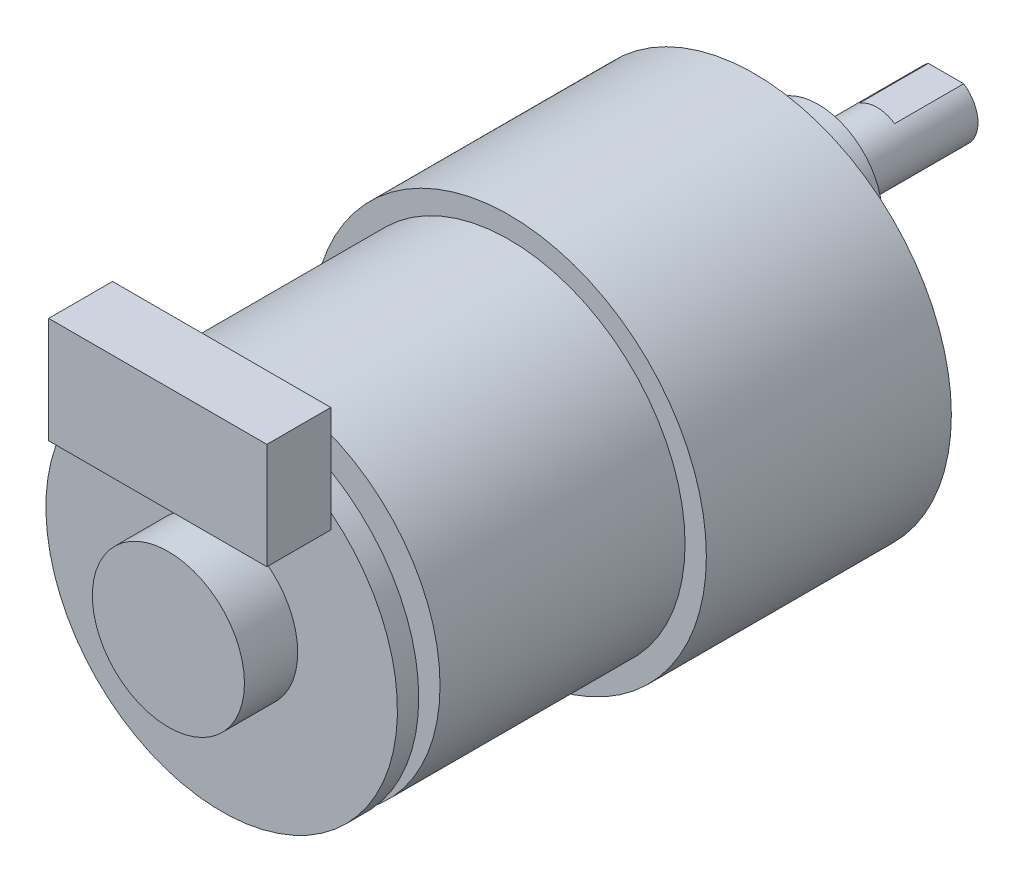
from build123d import *

# Parameters (mm, degrees)
SKETCH_1_R               = 18.5
EXTRUDE_1_DEPTH          = 23
SKETCH_2_R               = 16.5
EXTRUDE_2_DEPTH          = 23
SKETCH_3_R               = 6
EXTRUDE_3_DEPTH          = 6
SKETCH_4_R               = 3
EXTRUDE_4_DEPTH          = 12
CUT_EXTRUDE_1_DEPTH      = 53.919750566
CUT_EXTRUDE_1_DEPTH_BACK = 53.919750566
SKETCH_5_W               = 8.515862451
SKETCH_5_H               = 10.43869594
SKETCH_6_R               = 1
EXTRUDE_5_DEPTH          = 2
SKETCH_7_R               = 16.5
EXTRUDE_6_DEPTH          = 2
SKETCH_8_R               = 7.139531777
EXTRUDE_7_DEPTH          = 5
SKETCH_9_W               = 20.48733328
SKETCH_9_H               = 9.95175006
EXTRUDE_8_DEPTH          = 6
SKETCH_10_R              = 1.5
CUT_EXTRUDE_2_DEPTH      = 2


with BuildPart() as part:
    # 草图1 → 凸台-拉伸1 (new body)
    with BuildSketch(Plane.XY):
        Circle(SKETCH_1_R)
    extrude(amount=EXTRUDE_1_DEPTH)

    # 草图2 → 凸台-拉伸2 (add)
    with BuildSketch(Plane.XY.offset(23)):
        Circle(SKETCH_2_R)
    extrude(amount=EXTRUDE_2_DEPTH)

    # 草图3 → 凸台-拉伸3 (add)
    with BuildSketch(Plane(origin=(0, 0, 0), x_dir=(-1, 0, 0), z_dir=(0, 0, -1))):
        with Locations(Location((0, 7, 0), (0, 0, 180))):
            Circle(SKETCH_3_R)
    extrude(amount=EXTRUDE_3_DEPTH)

    # 草图4 → 凸台-拉伸4 (add)
    with BuildSketch(Plane(origin=(0, 0, -6), x_dir=(-1, 0, 0), z_dir=(0, 0, -1))):
        with Locations((0, 7)):
            Circle(SKETCH_4_R)
    extrude(amount=EXTRUDE_4_DEPTH)

    # 草图5 → 切除-拉伸1 (cut, two sides: drawn at the far end of the back side and taken through both)
    with BuildSketch(Plane(origin=(0, 0, 0), x_dir=(0, 0, -1), z_dir=(1, 0, 0)).offset(-CUT_EXTRUDE_1_DEPTH_BACK)):
        with Locations((15.772473003, 14.71934797)):
            Rectangle(SKETCH_5_W, SKETCH_5_H)
    extrude(amount=CUT_EXTRUDE_1_DEPTH + CUT_EXTRUDE_1_DEPTH_BACK, mode=Mode.SUBTRACT)

    # 草图6 → 凸台-拉伸5 (add)
    with BuildSketch(Plane.XY.offset(46)):
        with Locations((-10, 0)):
            Circle(SKETCH_6_R)
        with Locations((10, 0)):
            Circle(SKETCH_6_R)
    extrude(amount=EXTRUDE_5_DEPTH)

    # 草图7 → 凸台-拉伸6 (add)
    with BuildSketch(Plane.XY.offset(48)):
        Circle(SKETCH_7_R)
    extrude(amount=EXTRUDE_6_DEPTH)

    # 草图8 → 凸台-拉伸7 (add)
    with BuildSketch(Plane.XY.offset(50)):
        Circle(SKETCH_8_R)
    extrude(amount=EXTRUDE_7_DEPTH)

    # 草图9 → 凸台-拉伸8 (add)
    with BuildSketch(Plane.XY.offset(50)):
        with Locations((0, 16.5)):
            Rectangle(SKETCH_9_W, SKETCH_9_H)
    extrude(amount=EXTRUDE_8_DEPTH)

    # 草图10 → 切除-拉伸2 (cut)
    with BuildSketch(Plane(origin=(0, 0, 0), x_dir=(-1, 0, 0), z_dir=(0, 0, -1))):
        with Locations((15.5, 0)):
            Circle(SKETCH_10_R)
        with Locations((7.75, -13.423393759)):
            Circle(SKETCH_10_R)
        with Locations((-7.75, -13.423393759)):
            Circle(SKETCH_10_R)
        with Locations((-15.5, 0)):
            Circle(SKETCH_10_R)
        with Locations((-7.75, 13.423393759)):
            Circle(SKETCH_10_R)
        with Locations((7.75, 13.423393759)):
            Circle(SKETCH_10_R)
    extrude(amount=-CUT_EXTRUDE_2_DEPTH, mode=Mode.SUBTRACT)


solid = part.part
